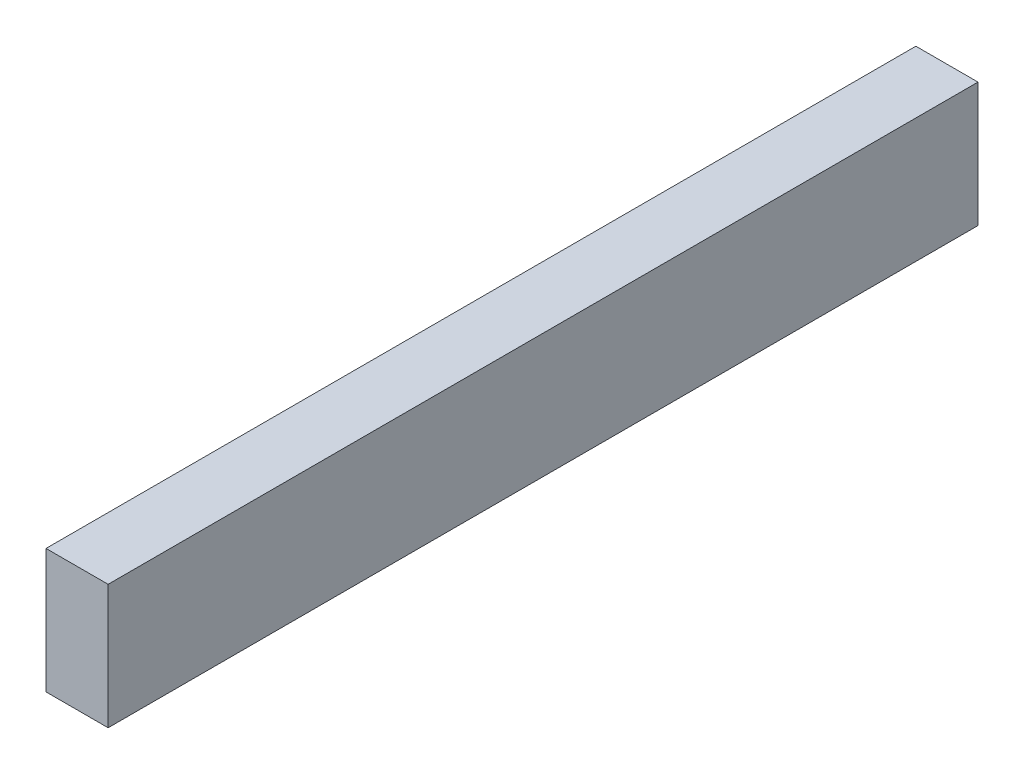
from build123d import *

# Parameters (mm, degrees)
SKETCH1_W           = 50.8
SKETCH1_H           = 101.6
BOSS_EXTRUDE1_DEPTH = 711.2


with BuildPart() as part:
    # Sketch1 → Boss-Extrude1 (new body)
    with BuildSketch(Plane.XY):
        Rectangle(SKETCH1_W, SKETCH1_H)
    extrude(amount=BOSS_EXTRUDE1_DEPTH)


solid = part.part
